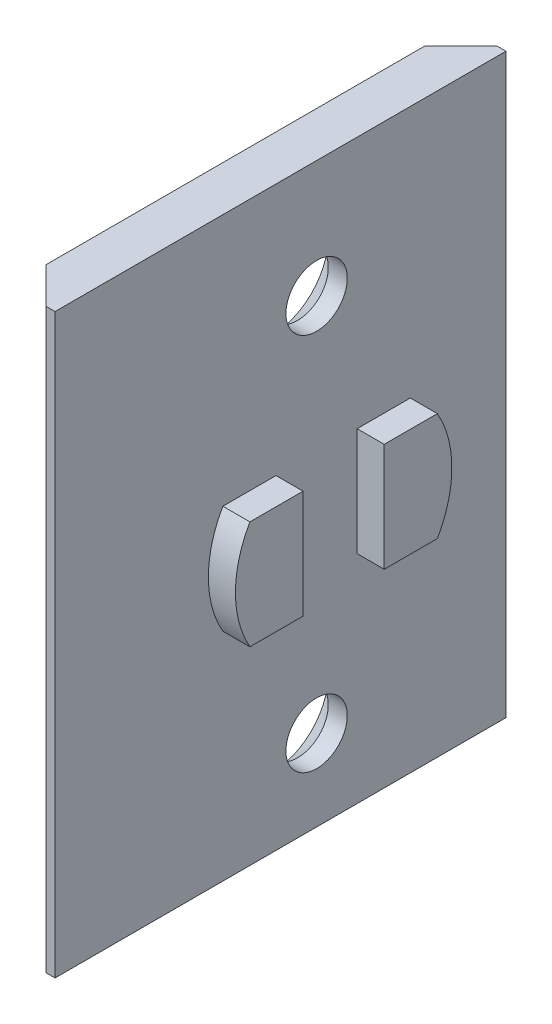
from build123d import *

# Parameters (mm, degrees)
SKETCH_1_W                 = 25
SKETCH_1_H                 = 32
EXTRUDE_1_DEPTH            = 2.5
CHAMFER_1_SIZE             = 2
HOLE_WIZARD_M31_AT_2_COUNT = 2
HOLE_WIZARD_M31_AT_2_PITCH = 21
SKETCH_4_R                 = 6
SKETCH_4_R_2               = 3.5
EXTRUDE_2_DEPTH            = 1.5
SKETCH_5_W                 = 4.5
SKETCH_5_H                 = 16
CUT_EXTRUDE_1_DEPTH        = 1.5
CUT_EXTRUDE_START          = -1.5
CUT_EXTRUDE_2_DEPTH        = 1.5


with BuildPart() as part:
    # Эскиз1 → Бобышка-Вытянуть1 (new body)
    with BuildSketch(Plane(origin=(0, 0, 0), x_dir=(0, 0, -1), z_dir=(1, 0, 0))):
        Rectangle(SKETCH_1_W, SKETCH_1_H)
    extrude(amount=EXTRUDE_1_DEPTH)

    # Фаска1
    chamfer_1_edges = [part.edges().sort_by_distance(p)[0] for p in [
        (0, 0, 12.5),
        (0, 0, -12.5),
    ]]
    chamfer(chamfer_1_edges, length=CHAMFER_1_SIZE)

    # Эскиз3 → Зенковка для  винта с плоской головкой M31 (revolve, cut)
    with BuildSketch(Plane(origin=(0, -11.5, -2), x_dir=(0, 0, 1), z_dir=(0, 1, 0))):
        Polygon((0, 0), (0, 2.5), (1.7, 2.5), (1.7, 1.45), (3.15, 0), align=None)
    hole_wizard_m31 = revolve(axis=Axis((-6.35, -11.5, -2), (1, 0, 0)), mode=Mode.SUBTRACT)

    # Зенковка для  винта с плоской головкой M31 at 2: Зенковка для  винта с плоской головкой M31 ×2
    with Locations(*[(0, i * HOLE_WIZARD_M31_AT_2_PITCH, 0) for i in range(1, HOLE_WIZARD_M31_AT_2_COUNT)]):
        add(hole_wizard_m31, mode=Mode.SUBTRACT)

    # Эскиз4 → Бобышка-Вытянуть2 (add)
    # profile 1 of 3: a face of its own
    with BuildSketch(Plane(origin=(2.5, 0, 0), x_dir=(0, 0, -1), z_dir=(1, 0, 0))):
        with Locations(Location((2, -1, 0), (0, 0, 180))):
            Circle(SKETCH_4_R)
        with Locations((2, -1)):
            Circle(SKETCH_4_R_2, mode=Mode.SUBTRACT)
    # profile 2 of 3: a face of its own
    with BuildSketch(Plane(origin=(2.5, 0, 0), x_dir=(0, 0, -1), z_dir=(1, 0, 0))):
        with BuildLine():
            ThreePointArc((-0.25, 1.680951324), (-1.5, -1), (-0.25, -3.680951324))
            Line((-0.25, -3.680951324), (-0.25, 1.680951324))
        make_face()
    # profile 3 of 3: a face of its own
    with BuildSketch(Plane(origin=(2.5, 0, 0), x_dir=(0, 0, -1), z_dir=(1, 0, 0))):
        with BuildLine():
            Line((4.25, 1.680951324), (4.25, -3.680951324))
            ThreePointArc((4.25, -3.680951324), (5.172144385, -2.479019946), (5.5, -1))
            ThreePointArc((5.5, -1), (5.172144385, 0.479019946), (4.25, 1.680951324))
        make_face()
    extrude(amount=EXTRUDE_2_DEPTH)

    # Эскиз5 → Вырез-Вытянуть1 (cut)
    with BuildSketch(Plane(origin=(4, 0, 0), x_dir=(0, 0, -1), z_dir=(1, 0, 0))):
        with Locations((2, -1)):
            Rectangle(SKETCH_5_W, SKETCH_5_H)
    extrude(amount=-CUT_EXTRUDE_1_DEPTH, mode=Mode.SUBTRACT)

    # Эскиз6 → Вырез-Вытянуть2 (cut)
    with BuildSketch(Plane(origin=(4, 0, 0), x_dir=(0, 0, -1), z_dir=(1, 0, 0)).offset(CUT_EXTRUDE_START)):
        with BuildLine():
            ThreePointArc((4.25, 4.562148865), (0.047794779, 4.67352578), (-3.196152423, 2))
            Line((-3.196152423, 2), (4.25, 2))
            Line((4.25, 2), (4.25, 4.562148865))
        make_face()
        with BuildLine():
            Line((4.25, 4.562148865), (4.25, 2))
            Line((4.25, 2), (7.196152423, 2))
            ThreePointArc((7.196152423, 2), (5.937314844, 3.527422205), (4.25, 4.562148865))
        make_face()
        with BuildLine():
            Line((4.25, 4.562148865), (4.25, 2))
            Line((4.25, 2), (7.196152423, 2))
            ThreePointArc((7.196152423, 2), (5.937314844, 3.527422205), (4.25, 4.562148865))
        make_face()
        with BuildLine():
            Line((4.25, -4), (-3.196152423, -4))
            ThreePointArc((-3.196152423, -4), (0.047794779, -6.67352578), (4.25, -6.562148865))
            Line((4.25, -6.562148865), (4.25, -4))
        make_face()
        with BuildLine():
            Line((7.196152423, -4), (4.25, -4))
            Line((4.25, -4), (4.25, -6.562148865))
            ThreePointArc((4.25, -6.562148865), (5.937314844, -5.527422205), (7.196152423, -4))
        make_face()
        with BuildLine():
            Line((7.196152423, -4), (4.25, -4))
            Line((4.25, -4), (4.25, -6.562148865))
            ThreePointArc((4.25, -6.562148865), (5.937314844, -5.527422205), (7.196152423, -4))
        make_face()
    extrude(amount=CUT_EXTRUDE_2_DEPTH, mode=Mode.SUBTRACT)


solid = part.part
